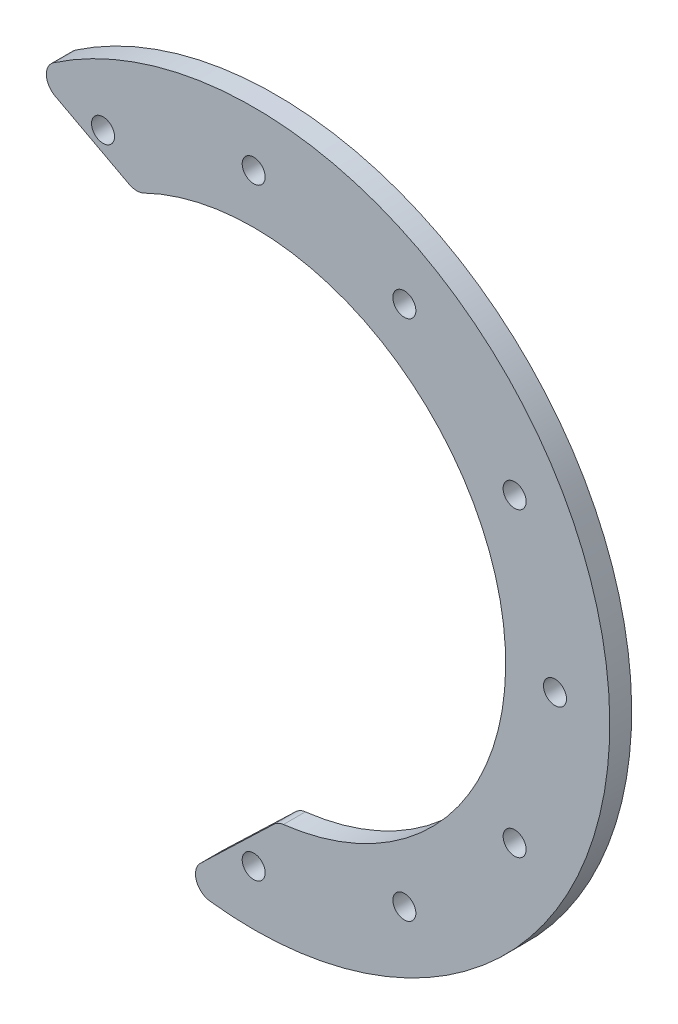
from build123d import *

# Parameters (mm, degrees)
SKETCH_1_R          = 65
SKETCH_1_R_2        = 46
EXTRUDE_1_DEPTH     = 4
SKETCH_2_R          = 2.1
CUT_EXTRUDE_1_DEPTH = 4
CUT_EXTRUDE_START   = -4
CUT_EXTRUDE_2_DEPTH = 4
FILLET_1_R          = 3
CUT_EXTRUDE_START_2 = -15
CUT_EXTRUDE_3_DEPTH = 15
FILLET_2_R          = 3


with BuildPart() as part:
    # 草图1 → 凸台-拉伸1 (new body)
    with BuildSketch(Plane.XY):
        Circle(SKETCH_1_R)
        Circle(SKETCH_1_R_2, mode=Mode.SUBTRACT)
    extrude(amount=EXTRUDE_1_DEPTH)

    # 草图2 → 切除-拉伸1 (cut)
    with BuildSketch(Plane.XY.offset(4)):
        with Locations((0, 55)):
            Circle(SKETCH_2_R)
        with Locations((27.5, 47.631397208)):
            Circle(SKETCH_2_R)
        with Locations((47.631397208, 27.5)):
            Circle(SKETCH_2_R)
        with Locations((55, 0)):
            Circle(SKETCH_2_R)
        with Locations((47.631397208, -27.5)):
            Circle(SKETCH_2_R)
        with Locations((27.5, -47.631397208)):
            Circle(SKETCH_2_R)
        with Locations((0, -55)):
            Circle(SKETCH_2_R)
        with Locations((-27.5, -47.631397208)):
            Circle(SKETCH_2_R)
        with Locations((-47.631397208, -27.5)):
            Circle(SKETCH_2_R)
        with Locations((-55, 0)):
            Circle(SKETCH_2_R)
        with Locations((-47.631397208, 27.5)):
            Circle(SKETCH_2_R)
        with Locations((-27.5, 47.631397208)):
            Circle(SKETCH_2_R)
    extrude(amount=-CUT_EXTRUDE_1_DEPTH, mode=Mode.SUBTRACT)

    # 草图3 → 切除-拉伸2 (cut)
    with BuildSketch(Plane.XY.offset(4).offset(CUT_EXTRUDE_START)):
        with BuildLine():
            Line((-40.462378993, 50.870383193), (27, 15))
            Line((27, 15), (-21.728491376, -61.260694271))
            ThreePointArc((-21.728491376, -61.260694271), (-64.11139308, -10.711175351), (-40.462378993, 50.870383193))
        make_face()
    extrude(amount=CUT_EXTRUDE_2_DEPTH, mode=Mode.SUBTRACT)

    # 圆角1
    fillet_1_edges = [part.edges().sort_by_distance(p)[0] for p in [
        (-11.107555195, -44.638797224, 2),
        (-21.385147835, 40.726839456, 2),
        (-21.728491376, -61.260694271, 2),
        (-40.462378993, 50.870383193, 2),
    ]]
    fillet(fillet_1_edges, radius=FILLET_1_R)

    # 草图4 → 切除-拉伸3 (cut)
    with BuildSketch(Plane.XY.offset(4).offset(CUT_EXTRUDE_START_2)):
        with BuildLine():
            Line((-37.660954125, -86.195196375), (4.448149198, -45.784429326))
            ThreePointArc((4.448149198, -45.784429326), (-2.360891137, -45.939375192), (-9.118175919, -45.087236197))
            ThreePointArc((-9.118175919, -45.087236197), (-10.884781804, -45.266086971), (-12.24083237, -46.412390079))
            Line((-12.24083237, -46.412390079), (-37.660954125, -86.195196375))
        make_face()
    extrude(amount=CUT_EXTRUDE_3_DEPTH, mode=Mode.SUBTRACT)

    # 圆角2
    fillet_2_edges = [part.edges().sort_by_distance(p)[0] for p in [
        (-13.988029274, -63.477043386, 2),
        (4.448149198, -45.784429326, 2),
    ]]
    fillet(fillet_2_edges, radius=FILLET_2_R)


solid = part.part
